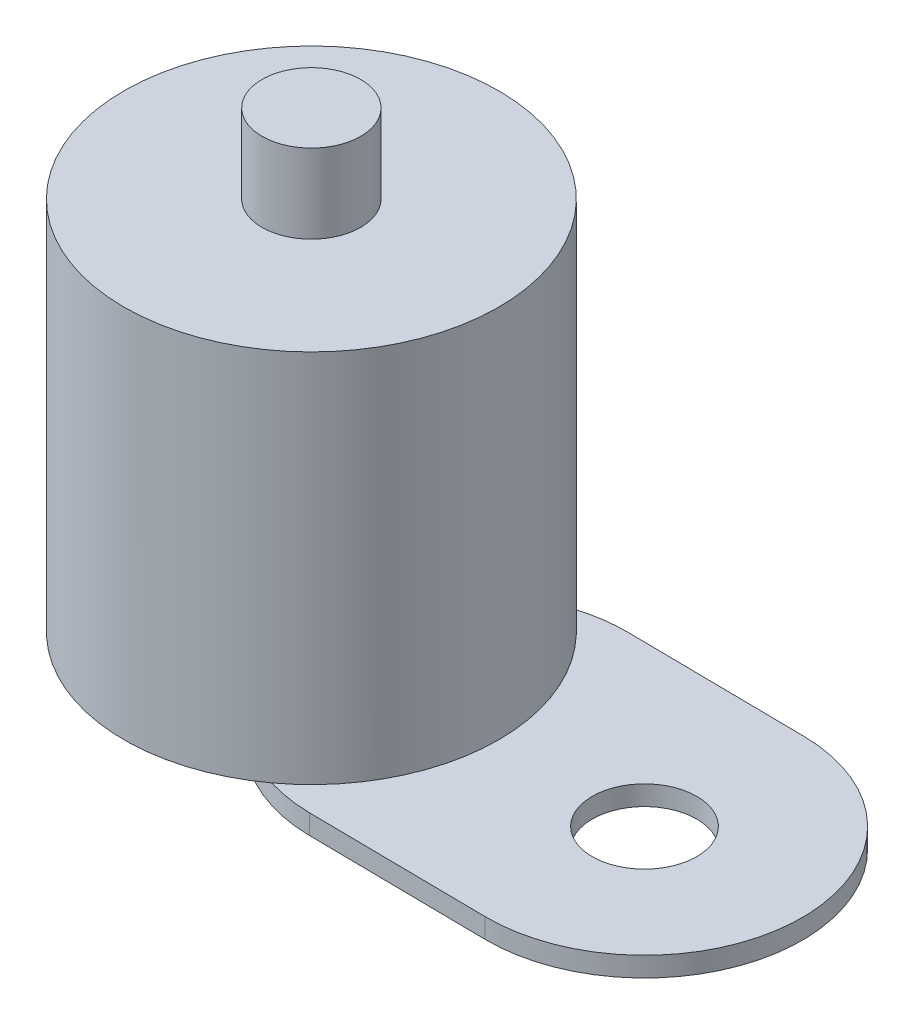
from build123d import *

# Parameters (mm, degrees)
SKETCH1_R           = 9.5
SKETCH1_R_2         = 2.5
BOSS_EXTRUDE1_DEPTH = 19
SKETCH2_R           = 2.5
BOSS_EXTRUDE2_DEPTH = 4
SKETCH3_R           = 2.65
BOSS_EXTRUDE3_DEPTH = 1


with BuildPart() as part:
    # Sketch1 → Boss-Extrude1 (new body)
    # profile 1 of 2: a face of its own
    with BuildSketch(Plane(origin=(0, 0, 0), x_dir=(1, 0, 0), z_dir=(0, 1, 0))):
        with Locations(Location((0, 0, 0), (0, 0, 270))):
            Circle(SKETCH1_R)
        Circle(SKETCH1_R_2, mode=Mode.SUBTRACT)
    # profile 2 of 2: a face of its own
    with BuildSketch(Plane(origin=(0, 0, 0), x_dir=(1, 0, 0), z_dir=(0, 1, 0))):
        Circle(SKETCH1_R_2)
    extrude(amount=BOSS_EXTRUDE1_DEPTH)

    # Sketch2 → Boss-Extrude2 (add)
    with BuildSketch(Plane(origin=(0, 19, 0), x_dir=(1, 0, 0), z_dir=(0, 1, 0))):
        with Locations(Location((0, 0, 0), (0, 0, 270))):
            Circle(SKETCH2_R)
    extrude(amount=BOSS_EXTRUDE2_DEPTH)

    # Sketch3 → Boss-Extrude3 (add)
    with BuildSketch(Plane.XZ):
        with BuildLine():
            Line((7.903037426, 7.99941237), (16.903037426, 8.108503279))
            ThreePointArc((16.903037426, 8.108503279), (24.99941237, 0.206053483), (17.096962574, -7.890321461))
            Line((17.096962574, -7.890321461), (8.096962574, -7.99941237))
            ThreePointArc((8.096962574, -7.99941237), (0.00058763, -0.096962574), (7.903037426, 7.99941237))
        make_face()
        with Locations(Location((17, 0.109090909, 0), (0, 0, 270))):
            Circle(SKETCH3_R, mode=Mode.SUBTRACT)
    extrude(amount=BOSS_EXTRUDE3_DEPTH)


solid = part.part
